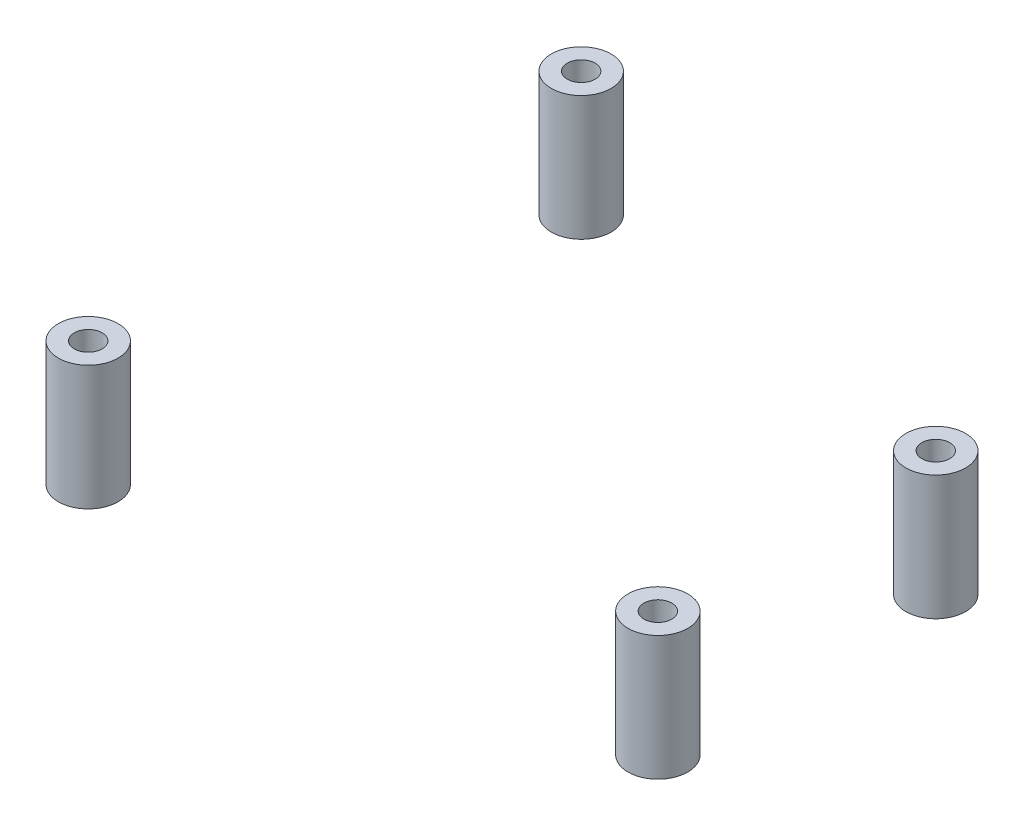
from build123d import *

# Parameters (mm, degrees)
SKETCH1_R             = 3
BOSS_EXTRUDE1_DEPTH   = 12.5
BOSS_EXTRUDE1_2_DEPTH = 12.5
BOSS_EXTRUDE1_3_DEPTH = 12.5
BOSS_EXTRUDE1_4_DEPTH = 12.5
SKETCH2_R             = 1.4
CUT_EXTRUDE1_DEPTH    = 10


with BuildPart() as part:
    # Sketch1 → Boss-Extrude1 (new body)
    with BuildSketch(Plane(origin=(0, 0, 0), x_dir=(1, 0, 0), z_dir=(0, 1, 0))):
        with Locations(Location((-10.962103361, 13.389179446, 0), (0, 0, 270))):
            Circle(SKETCH1_R)
    extrude(amount=BOSS_EXTRUDE1_DEPTH)


with BuildPart() as body_2:
    # Sketch1 → Boss-Extrude1 2 (new body)
    with BuildSketch(Plane(origin=(0, 0, 0), x_dir=(1, 0, 0), z_dir=(0, 1, 0))):
        with Locations(Location((-12.262103361, -34.810820554, 0), (0, 0, 270))):
            Circle(SKETCH1_R)
    extrude(amount=BOSS_EXTRUDE1_2_DEPTH)


with BuildPart() as body_3:
    # Sketch1 → Boss-Extrude1 3 (new body)
    with BuildSketch(Plane(origin=(0, 0, 0), x_dir=(1, 0, 0), z_dir=(0, 1, 0))):
        with Locations(Location((39.837896639, -29.710820554, 0), (0, 0, 270))):
            Circle(SKETCH1_R)
    extrude(amount=BOSS_EXTRUDE1_3_DEPTH)


with BuildPart() as body_4:
    # Sketch1 → Boss-Extrude1 4 (new body)
    with BuildSketch(Plane(origin=(0, 0, 0), x_dir=(1, 0, 0), z_dir=(0, 1, 0))):
        with Locations(Location((39.837896639, -1.810820554, 0), (0, 0, 270))):
            Circle(SKETCH1_R)
    extrude(amount=BOSS_EXTRUDE1_4_DEPTH)


with BuildPart() as cut_extrude1_tool:
    # Sketch2 → Cut-Extrude1 (new body)
    with BuildSketch(Plane(origin=(0, 12.5, 0), x_dir=(1, 0, 0), z_dir=(0, 1, 0))):
        with Locations(Location((-10.962103361, 13.389179446, 0), (0, 0, 270))):
            Circle(SKETCH2_R)
        with Locations(Location((39.837896639, -1.810820554, 0), (0, 0, 270))):
            Circle(SKETCH2_R)
        with Locations(Location((39.837896639, -29.710820554, 0), (0, 0, 270))):
            Circle(SKETCH2_R)
        with Locations(Location((-12.262103361, -34.810820554, 0), (0, 0, 270))):
            Circle(SKETCH2_R)
    extrude(amount=-CUT_EXTRUDE1_DEPTH)


with BuildPart() as part_1:
    add(part.part)

    # Cut-Extrude1: cut by cut_extrude1_tool
    add(cut_extrude1_tool.part, mode=Mode.SUBTRACT)


with BuildPart() as body_2_1:
    add(body_2.part)

    # Cut-Extrude1: cut by cut_extrude1_tool
    add(cut_extrude1_tool.part, mode=Mode.SUBTRACT)


with BuildPart() as body_3_1:
    add(body_3.part)

    # Cut-Extrude1: cut by cut_extrude1_tool
    add(cut_extrude1_tool.part, mode=Mode.SUBTRACT)


with BuildPart() as body_4_1:
    add(body_4.part)

    # Cut-Extrude1: cut by cut_extrude1_tool
    add(cut_extrude1_tool.part, mode=Mode.SUBTRACT)


solid = Compound([part_1.part, body_2_1.part, body_3_1.part, body_4_1.part])
